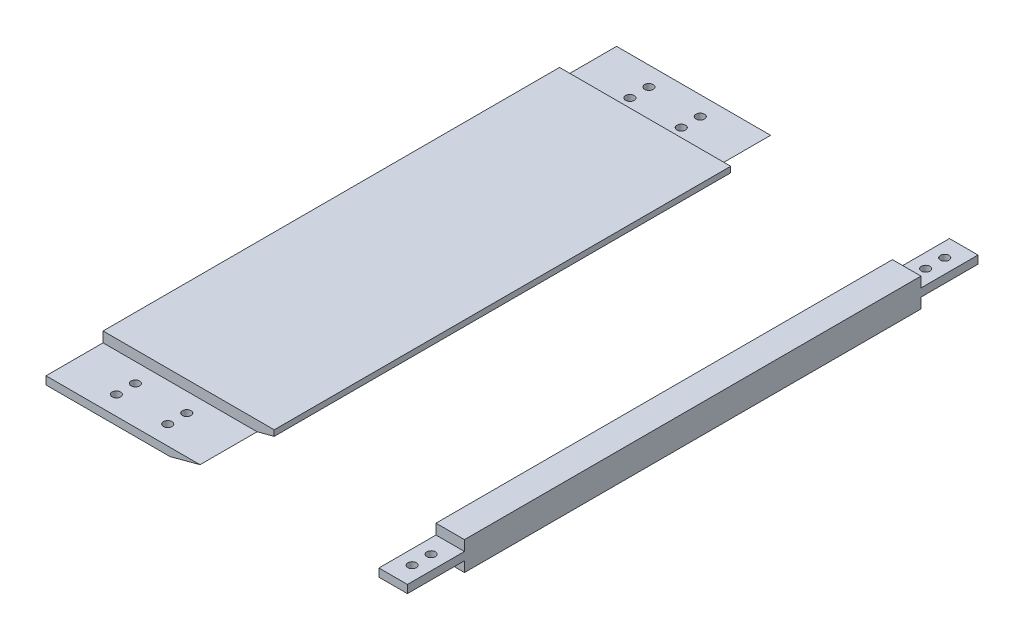
from build123d import *

# Parameters (mm, degrees)
AUFSATZ_LINEAR_AUSTRAGEN1_DEPTH   = 100
SKIZZE1_W                         = 5
SKIZZE1_H                         = 5
AUFSATZ_LINEAR_AUSTRAGEN1_2_DEPTH = 100
SKIZZE3_W                         = 63.343006578
SKIZZE3_H                         = 1.8
SCHNITT_LINEAR_AUSTRAGEN2_DEPTH   = 10
SCHNITT_LINEAR_START              = -90
SKIZZE3_3_W                       = 63.343006578
SKIZZE3_3_H                       = 1.8
SCHNITT_LINEAR_AUSTRAGEN3_DEPTH   = 10
SKIZZE4_R                         = 0.75
SCHNITT_LINEAR_AUSTRAGEN4_DEPTH   = 3.2
LINEARES_MUSTER1_COUNT            = 2
LINEARES_MUSTER1_PITCH            = 90


with BuildPart() as part:
    # Skizze1 → Aufsatz-Linear austragen1 (new body)
    with BuildSketch(Plane.XY):
        Polygon((-43.343006578, 0), (-28.343006578, 4), (-28.343006578, 5), (-58.343006578, 5), (-58.343006578, 0), align=None)
    extrude(amount=AUFSATZ_LINEAR_AUSTRAGEN1_DEPTH)


with BuildPart() as body_2:
    # Skizze1 → Aufsatz-Linear austragen1 2 (new body)
    with BuildSketch(Plane.XY):
        with Locations((2.5, 2.5)):
            Rectangle(SKIZZE1_W, SKIZZE1_H)
    extrude(amount=AUFSATZ_LINEAR_AUSTRAGEN1_2_DEPTH)


with BuildPart() as schnitt_linear_austragen2_tool:
    # Skizze3 → Schnitt-Linear austragen2 (new body)
    with BuildSketch(Plane(origin=(0, 0, 0), x_dir=(-1, 0, 0), z_dir=(0, 0, -1))):
        with Locations((26.671503289, 4.1)):
            Rectangle(SKIZZE3_W, SKIZZE3_H)
        with Locations((26.671503289, 0.9)):
            Rectangle(SKIZZE3_W, SKIZZE3_H)
    extrude(amount=-SCHNITT_LINEAR_AUSTRAGEN2_DEPTH)


with BuildPart() as part_1:
    add(part.part)

    # Schnitt-Linear austragen2: cut by schnitt_linear_austragen2_tool
    add(schnitt_linear_austragen2_tool.part, mode=Mode.SUBTRACT)


with BuildPart() as body_2_1:
    add(body_2.part)

    # Schnitt-Linear austragen2: cut by schnitt_linear_austragen2_tool
    add(schnitt_linear_austragen2_tool.part, mode=Mode.SUBTRACT)


with BuildPart() as schnitt_linear_austragen3_tool:
    # Skizze3<3> → Schnitt-Linear austragen3 (new body)
    with BuildSketch(Plane(origin=(0, 0, 0), x_dir=(-1, 0, 0), z_dir=(0, 0, -1)).offset(SCHNITT_LINEAR_START)):
        with Locations((26.671503289, 4.1)):
            Rectangle(SKIZZE3_3_W, SKIZZE3_3_H)
        with Locations((26.671503289, 0.9)):
            Rectangle(SKIZZE3_3_W, SKIZZE3_3_H)
    extrude(amount=-SCHNITT_LINEAR_AUSTRAGEN3_DEPTH)


with BuildPart() as part_2:
    add(part_1.part)

    # Schnitt-Linear austragen3: cut by schnitt_linear_austragen3_tool
    add(schnitt_linear_austragen3_tool.part, mode=Mode.SUBTRACT)


with BuildPart() as body_2_2:
    add(body_2_1.part)

    # Schnitt-Linear austragen3: cut by schnitt_linear_austragen3_tool
    add(schnitt_linear_austragen3_tool.part, mode=Mode.SUBTRACT)


with BuildPart() as schnitt_linear_austragen4_tool:
    # Skizze4 → Schnitt-Linear austragen4 (new body)
    with BuildSketch(Plane(origin=(0, 5, 0), x_dir=(1, 0, 0), z_dir=(0, 1, 0))):
        with Locations(Location((-49.343006578, -3.333333333, 0), (0, 0, 270))):
            Circle(SKIZZE4_R)
        with Locations(Location((-49.343006578, -6.666666667, 0), (0, 0, 270))):
            Circle(SKIZZE4_R)
        with Locations(Location((-40.343006578, -3.333333333, 0), (0, 0, 270))):
            Circle(SKIZZE4_R)
        with Locations(Location((-40.343006578, -6.666666667, 0), (0, 0, 270))):
            Circle(SKIZZE4_R)
        with Locations(Location((2.5, -3.333333333, 0), (0, 0, 270))):
            Circle(SKIZZE4_R)
        with Locations(Location((2.5, -6.666666667, 0), (0, 0, 270))):
            Circle(SKIZZE4_R)
    schnitt_linear_austragen4 = extrude(amount=-SCHNITT_LINEAR_AUSTRAGEN4_DEPTH)


with BuildPart() as part_3:
    add(part_2.part)

    # Schnitt-Linear austragen4: cut by schnitt_linear_austragen4_tool
    add(schnitt_linear_austragen4_tool.part, mode=Mode.SUBTRACT)


with BuildPart() as body_2_3:
    add(body_2_2.part)

    # Schnitt-Linear austragen4: cut by schnitt_linear_austragen4_tool
    add(schnitt_linear_austragen4_tool.part, mode=Mode.SUBTRACT)


with BuildPart() as lineares_muster1_tool:
    # Lineares Muster1: Schnitt-Linear austragen4 ×2
    with Locations(*[(0, 0, i * LINEARES_MUSTER1_PITCH) for i in range(1, LINEARES_MUSTER1_COUNT)]):
        add(schnitt_linear_austragen4)


with BuildPart() as part_4:
    add(part_3.part)

    # Lineares Muster1: cut by lineares_muster1_tool
    add(lineares_muster1_tool.part, mode=Mode.SUBTRACT)


with BuildPart() as body_2_4:
    add(body_2_3.part)

    # Lineares Muster1: cut by lineares_muster1_tool
    add(lineares_muster1_tool.part, mode=Mode.SUBTRACT)


solid = Compound([part_4.part, body_2_4.part])
